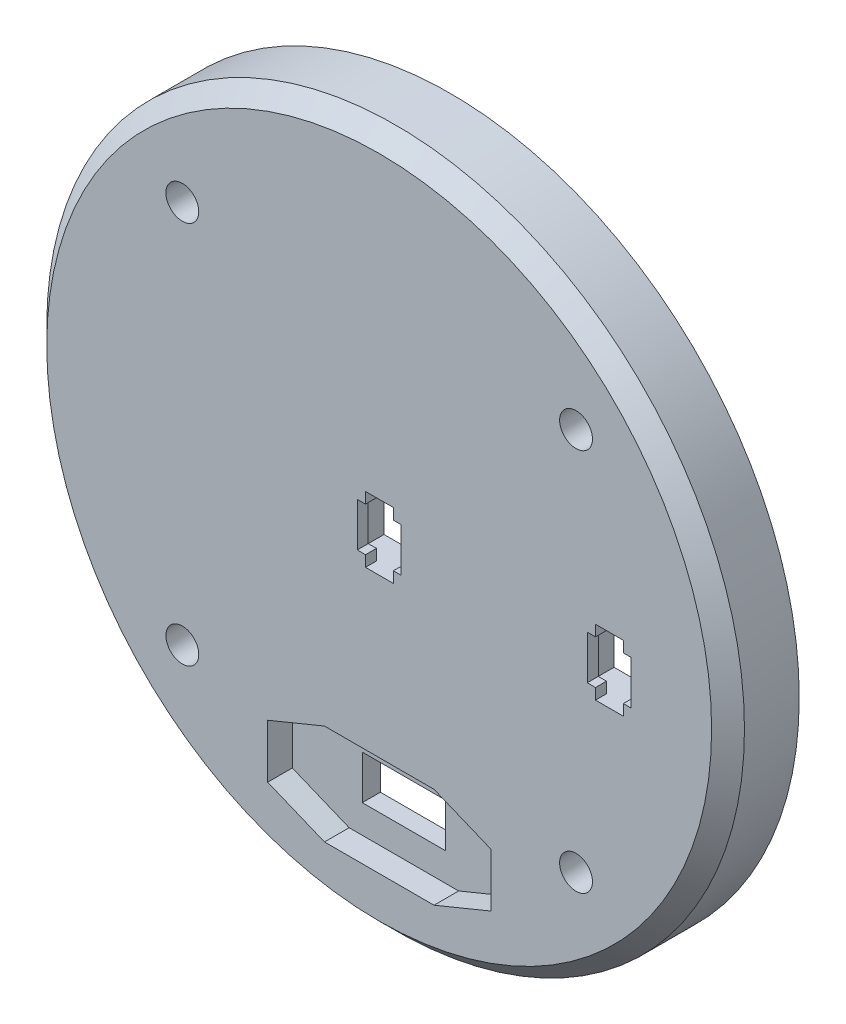
from build123d import *

# Parameters (mm, degrees)
SKETCH2_R           = 31.85
BOSS_EXTRUDE1_DEPTH = 6.5
SKETCH3_W           = 6
SKETCH3_H           = 6
CUT_EXTRUDE1_DEPTH  = 6.5
CHAMFER1_SIZE       = 6
CHAMFER1_SIZE2      = 3.057152697
SKETCH5_R           = 1.5
CUT_EXTRUDE2_DEPTH  = 56.252556502
SKETCH6_R           = 3
CUT_EXTRUDE3_DEPTH  = 3
CHAMFER3_SIZE       = 1.5
BOSS_EXTRUDE2_DEPTH = 1
SKETCH10_W          = 7.6
SKETCH10_H          = 4
CUT_EXTRUDE5_DEPTH  = 46.509284767
CUT_EXTRUDE6_DEPTH  = 2.25
CHAMFER4_SIZE       = 4
CHAMFER4_SIZE2      = 2.597630373


with BuildPart() as part:
    # Sketch2 → Boss-Extrude1 (new body)
    with BuildSketch(Plane.XY.offset(-25.5)):
        Circle(SKETCH2_R)
    extrude(amount=-BOSS_EXTRUDE1_DEPTH)

    # Sketch3 → Cut-Extrude1 (cut)
    with BuildSketch(Plane(origin=(0, 0, -32), x_dir=(-1, 0, 0), z_dir=(0, 0, -1))):
        with Locations((-21, 0)):
            Rectangle(SKETCH3_W, SKETCH3_H)
        Rectangle(SKETCH3_W, SKETCH3_H)
    extrude(amount=-CUT_EXTRUDE1_DEPTH, mode=Mode.SUBTRACT)

    # Chamfer1
    chamfer1_edges = [part.edges().sort_by_distance(p)[0] for p in [
        (3, 0, -32),
        (0, -3, -32),
        (-3, 0, -32),
        (0, 3, -32),
        (24, 0, -32),
        (21, -3, -32),
        (18, 0, -32),
        (21, 3, -32),
    ]]
    chamfer1_side = [part.faces().sort_by_distance(p)[0] for p in [
        (-30.949145961, 0, -32),
    ]]
    chamfer(chamfer1_edges, length=CHAMFER1_SIZE, length2=CHAMFER1_SIZE2, reference=chamfer1_side[0])

    # Sketch5 → Cut-Extrude2 (cut, through all)
    with BuildSketch(Plane.XY):
        with Locations((-17.971861544, -17.500238124)):
            Circle(SKETCH5_R)
        with Locations((17.971861544, -17.500238124)):
            Circle(SKETCH5_R)
        with Locations((17.971861544, 17.500238124)):
            Circle(SKETCH5_R)
        with Locations((-17.971861544, 17.500238124)):
            Circle(SKETCH5_R)
    extrude(amount=-CUT_EXTRUDE2_DEPTH, mode=Mode.SUBTRACT)

    # Sketch6 → Cut-Extrude3 (cut)
    with BuildSketch(Plane.XY.offset(-32)):
        with Locations((-17.971861544, -17.500238124)):
            Circle(SKETCH6_R)
        with Locations(Location((17.971861544, -17.500238124, 0), (0, 0, 180))):
            Circle(SKETCH6_R)
        with Locations((17.971861544, 17.500238124)):
            Circle(SKETCH6_R)
        with Locations(Location((-17.971861544, 17.500238124, 0), (0, 0, 180))):
            Circle(SKETCH6_R)
    extrude(amount=CUT_EXTRUDE3_DEPTH, mode=Mode.SUBTRACT)

    # Chamfer3
    chamfer3_edges = [part.edges().sort_by_distance(p)[0] for p in [
        (-31.85, 0, -25.5),
    ]]
    chamfer(chamfer3_edges, length=CHAMFER3_SIZE)

    # Sketch7 → Boss-Extrude2 (add)
    with BuildSketch(Plane.XY.offset(-25.5)):
        Polygon((-1.25, -2), (-2, -2), (-2, 2), (-1.25, 2), (-1.25, 3), (-3, 3), (-3, -3), (-1.25, -3), align=None)
        Polygon((1.2909118, -3), (3, -3), (3, 3), (1.2909118, 3), (1.2909118, 2), (2, 2), (2, -2), (1.2909118, -2), align=None)
        Polygon((19.75, -2), (19, -2), (19, 2), (19.75, 2), (19.75, 3), (18, 3), (18, -3), (19.75, -3), align=None)
        Polygon((22.2909118, -3), (24, -3), (24, 3), (22.2909118, 3), (22.2909118, 2), (23, 2), (23, -2), (22.2909118, -2), align=None)
    extrude(amount=-BOSS_EXTRUDE2_DEPTH)

    # Sketch10 → Cut-Extrude5 (cut, through all)
    with BuildSketch(Plane(origin=(0, 0, -32), x_dir=(-1, 0, 0), z_dir=(0, 0, -1))):
        with Locations((-0.006825443, -22.003067008)):
            Rectangle(SKETCH10_W, SKETCH10_H)
    extrude(amount=-CUT_EXTRUDE5_DEPTH, mode=Mode.SUBTRACT)

    # Sketch11 → Cut-Extrude6 (cut)
    with BuildSketch(Plane.XY.offset(-25.5)):
        Polygon((-4.993522574, -17.422135009), (5.007173461, -17.422135009), (10.193224733, -19.552209326), (10.193224733, -24.45392469), (5.007173461, -26.583999007), (-4.993522574, -26.583999007), (-10.179573846, -24.45392469), (-10.179573846, -19.552209326), align=None)
    extrude(amount=-CUT_EXTRUDE6_DEPTH, mode=Mode.SUBTRACT)

    # Chamfer4
    chamfer4_edges = [part.edges().sort_by_distance(p)[0] for p in [
        (-3.793174557, -22.003067008, -32),
        (0.006825443, -20.003067008, -32),
        (3.806825443, -22.003067008, -32),
        (0.006825443, -24.003067008, -32),
    ]]
    chamfer4_side = [part.faces().sort_by_distance(p)[0] for p in [
        (-30.949145961, 0, -32),
    ]]
    chamfer(chamfer4_edges, length=CHAMFER4_SIZE, length2=CHAMFER4_SIZE2, reference=chamfer4_side[0])


solid = part.part
